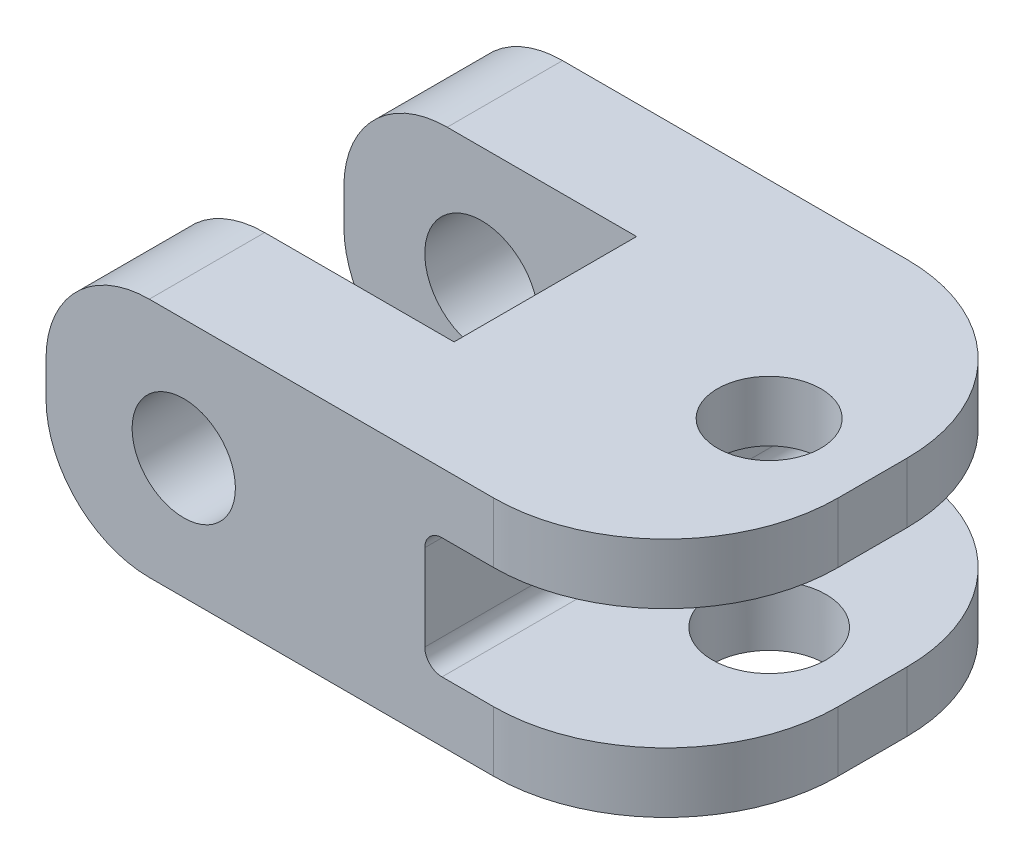
from build123d import *

# Parameters (mm, degrees)
SKETCH_1_W          = 18
SKETCH_1_H          = 7
SKETCH_1_R          = 1.65
EXTRUDE_1_DEPTH     = 12
SKETCH_2_W          = 8.5
SKETCH_2_H          = 5.3
CUT_EXTRUDE_1_DEPTH = 12
SKETCH_3_W          = 14
SKETCH_3_H          = 3.5
CUT_EXTRUDE_2_DEPTH = 12
SKETCH_4_R          = 1.65
CUT_EXTRUDE_3_DEPTH = 12
FILLET_1_R          = 5
FILLET_2_R          = 3
FILLET_3_R          = 0.5
SKETCH_6_R          = 1.65
SKETCH_6_R_2        = 1.5
EXTRUDE_2_DEPTH     = 3.35
EXTRUDE_START       = -1.75
SKETCH_7_R          = 1.65
SKETCH_7_R_2        = 1.5
EXTRUDE_3_DEPTH     = 1.75


with BuildPart() as part:
    # 草图1 → 凸台-拉伸1 (new body)
    with BuildSketch(Plane.XY):
        Rectangle(SKETCH_1_W, SKETCH_1_H)
        with Locations((-5, 0)):
            Circle(SKETCH_1_R, mode=Mode.SUBTRACT)
    extrude(amount=EXTRUDE_1_DEPTH)

    # 草图2 → 切除-拉伸1 (cut)
    with BuildSketch(Plane(origin=(0, 3.5, 0), x_dir=(1, 0, 0), z_dir=(0, 1, 0))):
        with Locations((-4.75, -6)):
            Rectangle(SKETCH_2_W, SKETCH_2_H)
    extrude(amount=-CUT_EXTRUDE_1_DEPTH, mode=Mode.SUBTRACT)

    # 草图3 → 切除-拉伸2 (cut)
    with BuildSketch(Plane.XY.offset(12)):
        with Locations((9, 0)):
            Rectangle(SKETCH_3_W, SKETCH_3_H)
    extrude(amount=-CUT_EXTRUDE_2_DEPTH, mode=Mode.SUBTRACT)

    # 草图4 → 切除-拉伸3 (cut)
    with BuildSketch(Plane(origin=(0, 3.5, 0), x_dir=(1, 0, 0), z_dir=(0, 1, 0))):
        with Locations(Location((6, -6, 0), (0, 0, 270))):
            Circle(SKETCH_4_R)
    extrude(amount=-CUT_EXTRUDE_3_DEPTH, mode=Mode.SUBTRACT)

    # 圆角1
    fillet_1_edges = [part.edges().sort_by_distance(p)[0] for p in [
        (9, 2.625, 0),
        (9, 2.625, 12),
        (9, -2.625, 12),
        (9, -2.625, 0),
    ]]
    fillet(fillet_1_edges, radius=FILLET_1_R)

    # 圆角2
    fillet_2_edges = [part.edges().sort_by_distance(p)[0] for p in [
        (-9, -3.5, 1.675),
        (-9, 3.5, 1.675),
        (-9, -3.5, 10.325),
        (-9, 3.5, 10.325),
    ]]
    fillet(fillet_2_edges, radius=FILLET_2_R)

    # 圆角3
    fillet_3_edges = [part.edges().sort_by_distance(p)[0] for p in [
        (2, 1.75, 6),
        (2, -1.75, 6),
    ]]
    fillet(fillet_3_edges, radius=FILLET_3_R)

    # 草图6 → 凸台-拉伸2 (add)
    with BuildSketch(Plane(origin=(0, 0, 8.65), x_dir=(-1, 0, 0), z_dir=(0, 0, -1))):
        with Locations(Location((5, 0, 0), (0, 0, 180))):
            Circle(SKETCH_6_R)
        with Locations((5, 0)):
            Circle(SKETCH_6_R_2, mode=Mode.SUBTRACT)
    extrude(amount=-EXTRUDE_2_DEPTH)

    # 草图7 → 凸台-拉伸3 (add)
    with BuildSketch(Plane.XZ.offset(-1.75).offset(EXTRUDE_START)):
        with Locations(Location((6, 6, 0), (0, 0, 90))):
            Circle(SKETCH_7_R)
        with Locations(Location((6, 6, 0), (0, 0, 270))):
            Circle(SKETCH_7_R_2, mode=Mode.SUBTRACT)
    extrude(amount=EXTRUDE_3_DEPTH)


solid = part.part
